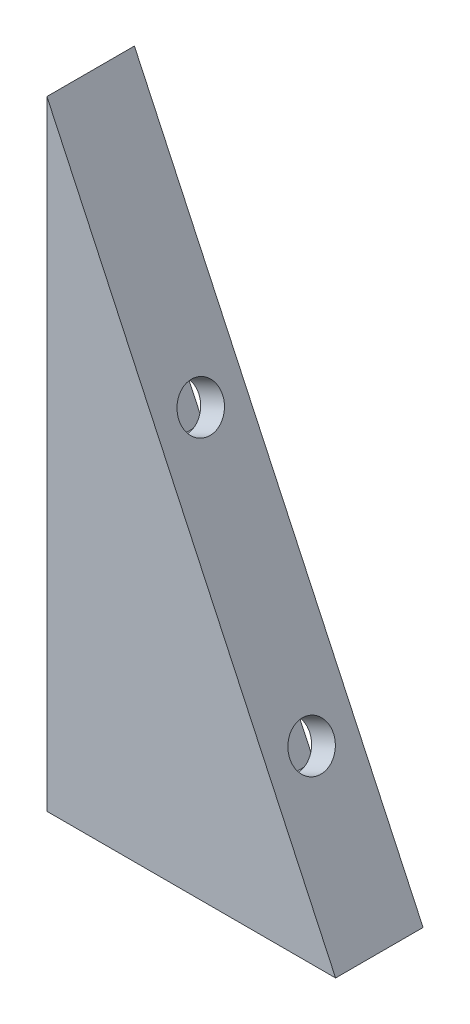
from build123d import *

# Parameters (mm, degrees)
BOSS_EXTRUDE1_DEPTH = 10
SKETCH2_W           = 5.8
SKETCH2_H           = 3.8
BOSS_EXTRUDE2_DEPTH = 2
SKETCH3_R           = 2.15
CUT_EXTRUDE1_DEPTH  = 12
CUT_EXTRUDE2_DEPTH  = 6.5
SKETCH5_W           = 7.6
SKETCH5_H           = 3.5
CUT_EXTRUDE3_DEPTH  = 6.5
CUT_EXTRUDE4_DEPTH  = 8.5
SKETCH8_R           = 2.5
CUT_EXTRUDE5_DEPTH  = 10


with BuildPart() as part:
    # Sketch1 → Boss-Extrude1 (new body)
    with BuildSketch(Plane.XY):
        Polygon((0, 70.768728377), (0, 0), (33, 0), align=None)
    extrude(amount=BOSS_EXTRUDE1_DEPTH)

    # Sketch2 → Boss-Extrude2 (add)
    with BuildSketch(Plane(origin=(0, 0, 0), x_dir=(-1, 0, 0), z_dir=(0, -1, 0))):
        with Locations((-16.5, -5)):
            Rectangle(SKETCH2_W, SKETCH2_H)
    extrude(amount=BOSS_EXTRUDE2_DEPTH)

    # Sketch3 → Cut-Extrude1 (cut)
    with BuildSketch(Plane(origin=(0, 0, 0), x_dir=(-1, 0, 0), z_dir=(0, -1, 0))):
        with Locations(Location((-23.331538291, -4, 0), (0, 0, 180))):
            Circle(SKETCH3_R)
        with Locations(Location((-8.551538291, -4, 0), (0, 0, 180))):
            Circle(SKETCH3_R)
    extrude(amount=-CUT_EXTRUDE1_DEPTH, mode=Mode.SUBTRACT)

    # Sketch4 → Cut-Extrude2 (cut)
    with BuildSketch(Plane(origin=(0, 0, 0), x_dir=(-1, 0, 0), z_dir=(0, 0, -1))):
        Polygon((-19.531538291, 3.25), (-19.531538291, 5), (-19.531538291, 6.75), (-27.131538291, 6.75), (-27.131538291, 5), (-27.131538291, 3.25), align=None)
    extrude(amount=-CUT_EXTRUDE2_DEPTH, mode=Mode.SUBTRACT)

    # Sketch5 → Cut-Extrude3 (cut)
    with BuildSketch(Plane(origin=(0, 0, 0), x_dir=(-1, 0, 0), z_dir=(0, 0, -1))):
        with Locations((-23.331538291, 5)):
            Rectangle(SKETCH5_W, SKETCH5_H)
        with Locations((-8.551538291, 5)):
            Rectangle(SKETCH5_W, SKETCH5_H)
    extrude(amount=-CUT_EXTRUDE3_DEPTH, mode=Mode.SUBTRACT)

    # Sketch7 → Cut-Extrude4 (cut)
    with BuildSketch(Plane(origin=(0, 0, 0), x_dir=(-1, 0, 0), z_dir=(0, 0, -1))):
        Polygon((-8.256472896, 45.964060362), (-4.631241748, 44.273587315), (-7.843140537, 37.385648134), (-11.468371686, 39.076121181), align=None)
        Polygon((-20.935020749, 18.774826751), (-17.3097896, 17.084353704), (-20.52168839, 10.196414523), (-24.146919538, 11.88688757), align=None)
    extrude(amount=-CUT_EXTRUDE4_DEPTH, mode=Mode.SUBTRACT)

    # Sketch8 → Cut-Extrude5 (cut)
    with BuildSketch(Plane(origin=(27.10599556, 12.639733311, 0), x_dir=(0, 0, -1), z_dir=(0.9063077870366479, 0.422618261740704, 0))):
        with Locations(Location((-5, 34.368249607, 0), (0, 0, 90))):
            Circle(SKETCH8_R)
        with Locations(Location((-5, 4.368249607, 0), (0, 0, 90))):
            Circle(SKETCH8_R)
    extrude(amount=-CUT_EXTRUDE5_DEPTH, mode=Mode.SUBTRACT)


solid = part.part
